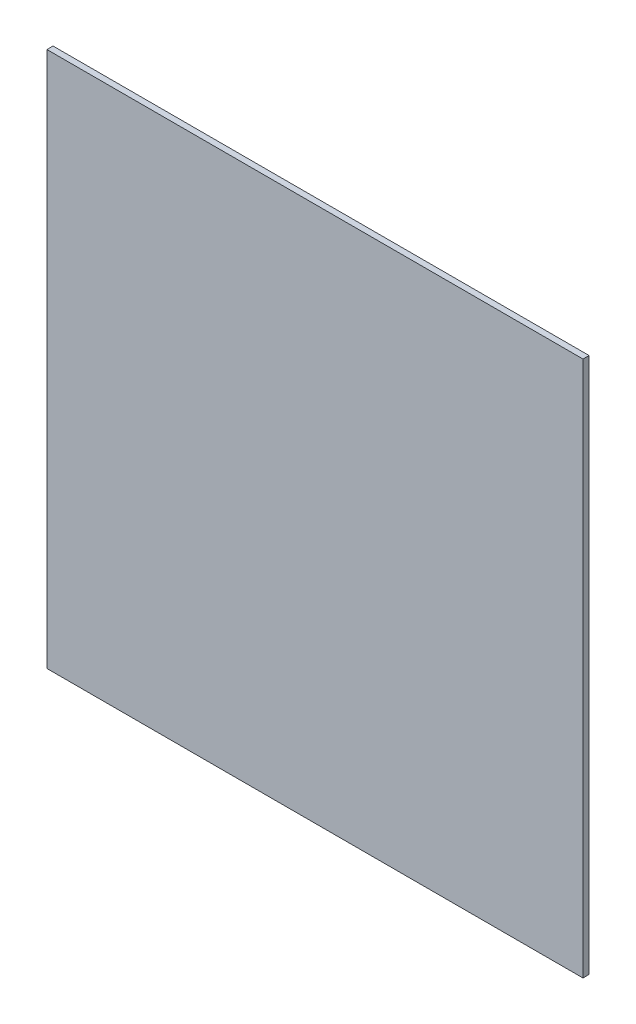
from build123d import *

# Parameters (mm, degrees)
SKETCH1_W           = 440
SKETCH1_H           = 440
BOSS_EXTRUDE1_DEPTH = 5


with BuildPart() as part:
    # Sketch1 → Boss-Extrude1 (new body)
    with BuildSketch(Plane.XY):
        Rectangle(SKETCH1_W, SKETCH1_H)
    extrude(amount=BOSS_EXTRUDE1_DEPTH)


solid = part.part
